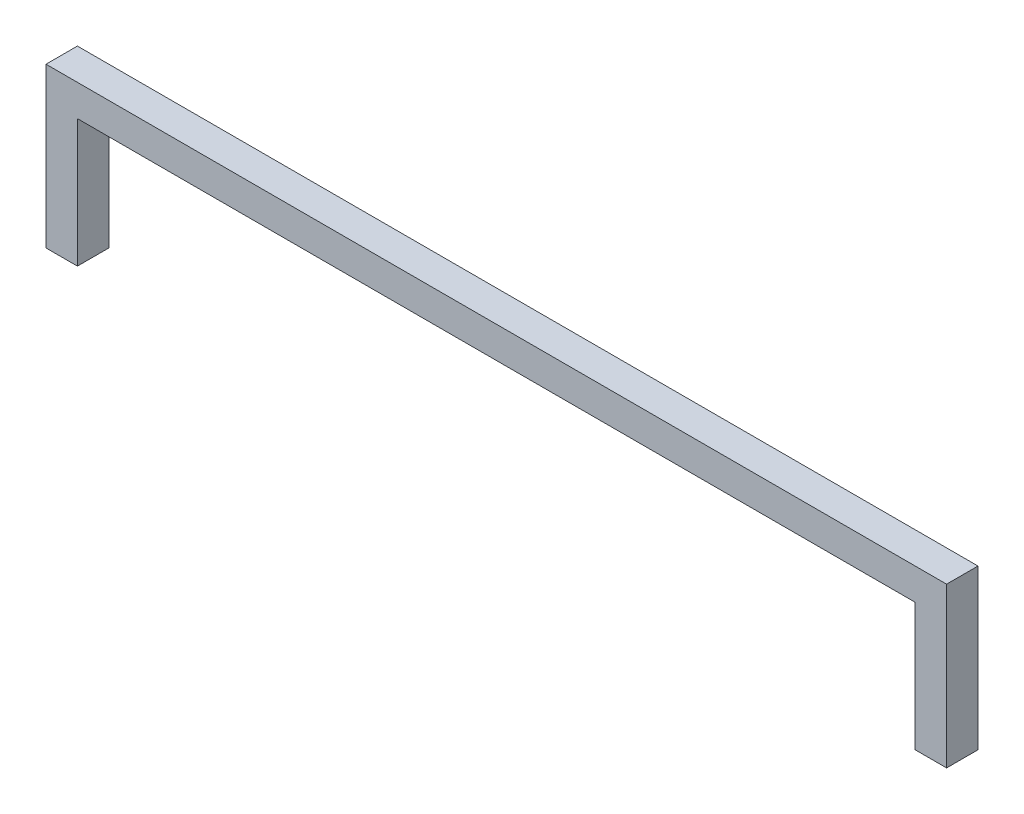
from build123d import *

# Parameters (mm, degrees)
EXTRUDE_1_DEPTH = 15


with BuildPart() as part:
    # 草图1 → 凸台-拉伸1 (new body)
    with BuildSketch(Plane.XY):
        Polygon((-30.618556701, -6.726804124), (-45.618556701, -6.726804124), (-45.618556701, 69.273195876), (384.381443299, 69.273195876), (384.381443299, -6.726804124), (369.381443299, -6.726804124), (369.381443299, 54.273195876), (-30.618556701, 54.273195876), align=None)
    extrude(amount=EXTRUDE_1_DEPTH)


solid = part.part
